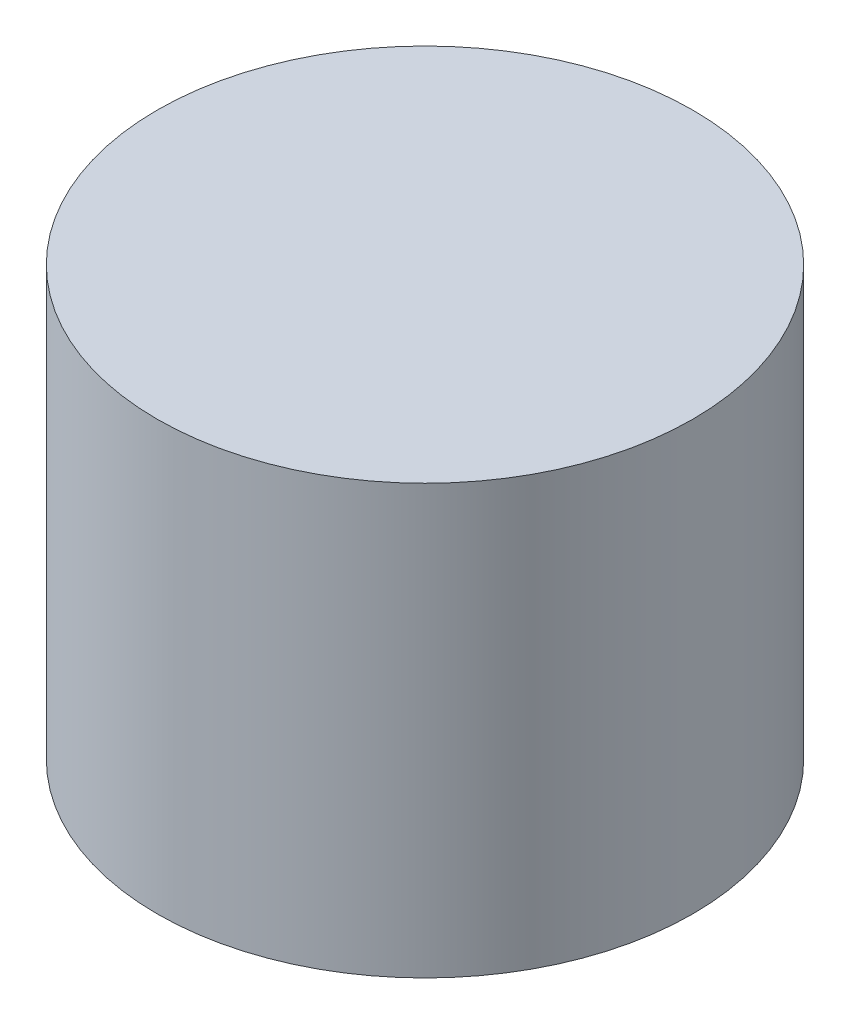
from build123d import *

# Parameters (mm, degrees)
SKETCH1_R           = 12.5
BOSS_EXTRUDE1_DEPTH = 20


with BuildPart() as part:
    # Sketch1 → Boss-Extrude1 (new body)
    with BuildSketch(Plane(origin=(0, 0, 0), x_dir=(1, 0, 0), z_dir=(0, 1, 0))):
        with Locations(Location((0, 0, 0), (0, 0, 270))):
            Circle(SKETCH1_R)
    extrude(amount=BOSS_EXTRUDE1_DEPTH)


solid = part.part
